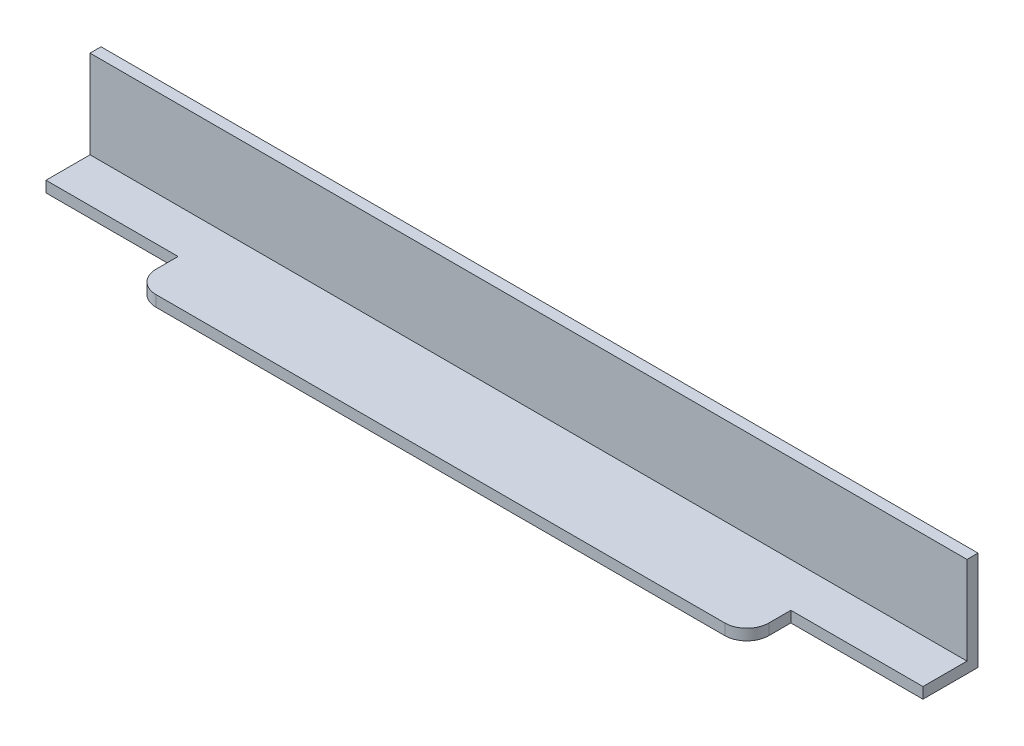
from build123d import *

# Parameters (mm, degrees)
SKETCH2_W           = 239
SKETCH2_H           = 27
BOSS_EXTRUDE1_DEPTH = 3
SKETCH3_W           = 239
SKETCH3_H           = 3
BOSS_EXTRUDE2_DEPTH = 12
BOSS_EXTRUDE4_DEPTH = 3


with BuildPart() as part:
    # Sketch2 → Boss-Extrude1 (new body)
    with BuildSketch(Plane.XY):
        with Locations((-119.5, -13.5)):
            Rectangle(SKETCH2_W, SKETCH2_H)
    extrude(amount=BOSS_EXTRUDE1_DEPTH)

    # Sketch3 → Boss-Extrude2 (add)
    with BuildSketch(Plane.XY.offset(3)):
        with Locations((-119.5, -25.5)):
            Rectangle(SKETCH3_W, SKETCH3_H)
    extrude(amount=BOSS_EXTRUDE2_DEPTH)

    # Sketch4 → Boss-Extrude4 (add)
    with BuildSketch(Plane(origin=(0, -24, 0), x_dir=(1, 0, 0), z_dir=(0, 1, 0))):
        with BuildLine():
            Line((-203, -15), (-36, -15))
            Line((-36, -15), (-36, -21))
            ThreePointArc((-36, -21), (-37.757359313, -25.242640687), (-42, -27))
            Line((-42, -27), (-197, -27))
            ThreePointArc((-197, -27), (-201.242640687, -25.242640687), (-203, -21))
            Line((-203, -21), (-203, -15))
        make_face()
    extrude(amount=-BOSS_EXTRUDE4_DEPTH)


solid = part.part
